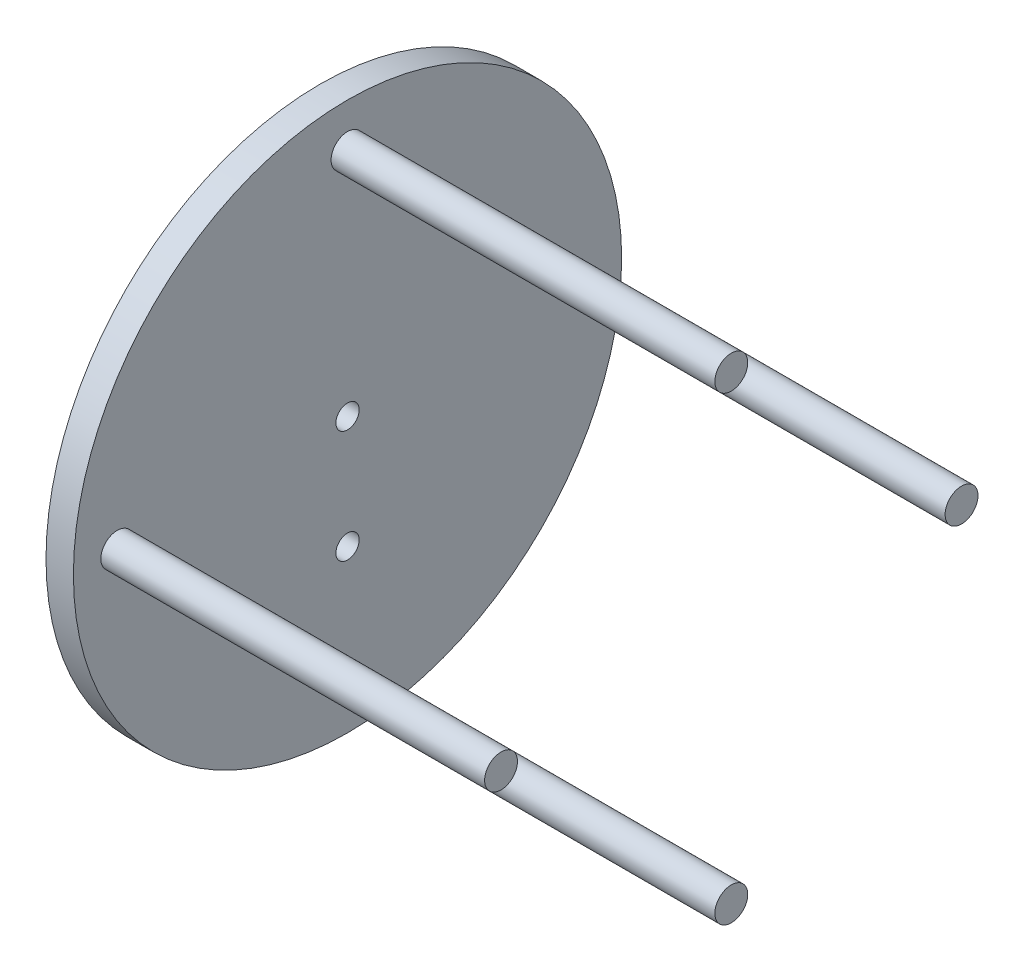
from build123d import *

# Parameters (mm, degrees)
ESQUISSE1_R             = 50
BOSS_EXTRU_1_DEPTH      = 5
ESQUISSE2_R             = 3
BOSS_EXTRU_3_DEPTH      = 70
ESQUISSE3_R             = 2.125
ENL_V_MAT_EXTRU_2_DEPTH = 70


with BuildPart() as part:
    # Esquisse1 → Boss.-Extru.1 (new body)
    with BuildSketch(Plane(origin=(0, 0, 0), x_dir=(0, 0, -1), z_dir=(1, 0, 0))):
        Circle(ESQUISSE1_R)
    extrude(amount=BOSS_EXTRU_1_DEPTH)

    # Esquisse2 → Boss.-Extru.3 (add)
    with BuildSketch(Plane(origin=(5, 0, 0), x_dir=(0, 0, -1), z_dir=(1, 0, 0))):
        with Locations((-42, 0)):
            Circle(ESQUISSE2_R)
        with Locations((42, 0)):
            Circle(ESQUISSE2_R)
        with Locations((0, -42)):
            Circle(ESQUISSE2_R)
        with Locations((0, 42)):
            Circle(ESQUISSE2_R)
    extrude(amount=BOSS_EXTRU_3_DEPTH)

    # Esquisse3 → Enlèv. mat.-Extru.2 (cut)
    with BuildSketch(Plane(origin=(5, 0, 0), x_dir=(0, 0, -1), z_dir=(1, 0, 0))):
        Circle(ESQUISSE3_R)
        with Locations((0, -20.547843558)):
            Circle(ESQUISSE3_R)
    extrude(amount=-ENL_V_MAT_EXTRU_2_DEPTH, mode=Mode.SUBTRACT)


solid = part.part
